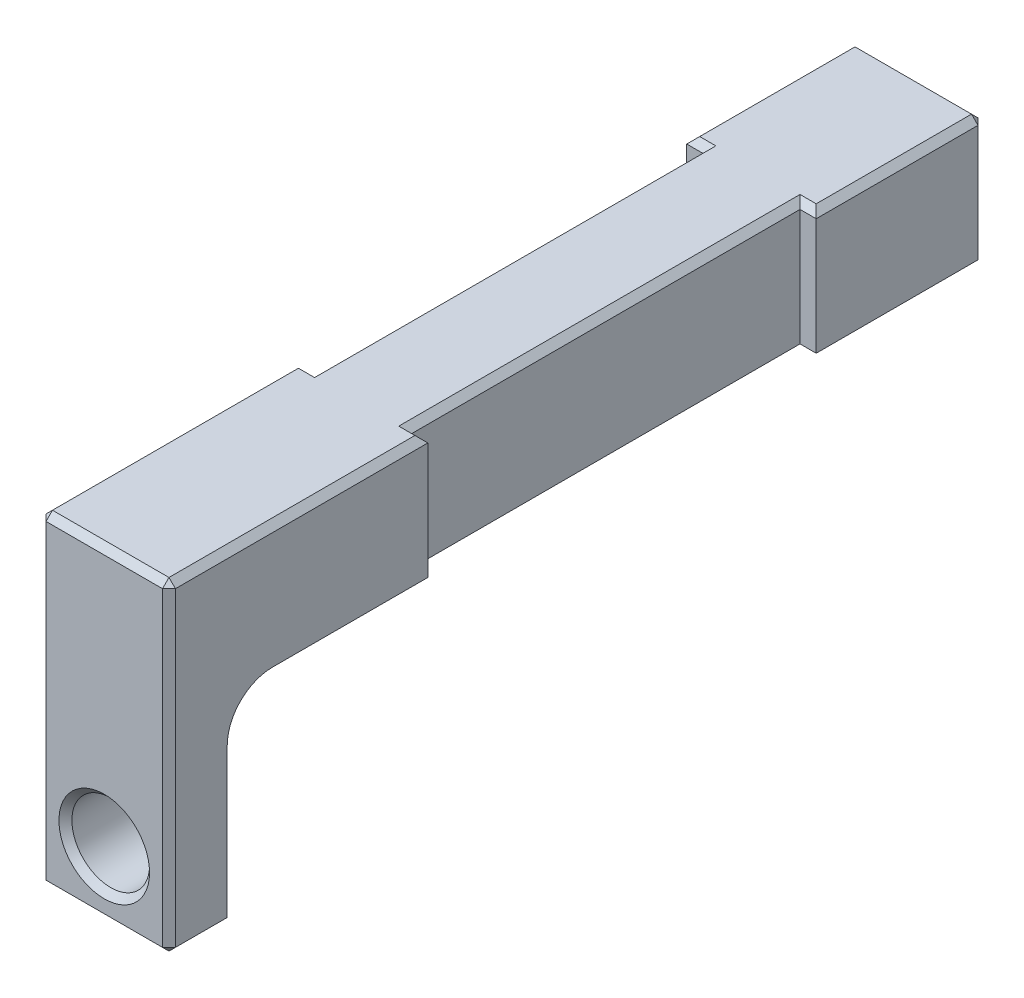
from build123d import *

# Parameters (mm, degrees)
SKETCH1_W            = 10
SKETCH1_H            = 58
BOSS_EXTRUDE1_DEPTH  = 10
CUT_EXTRUDE1_REACH   = 33.081
SKETCH2_W            = 1.25
SKETCH2_H            = 30
SKETCH3_W            = 10
SKETCH3_H            = 25
BOSS_EXTRUDE2_DEPTH  = 5
FILLET1_R            = 3
M5_CLEARANCE_HOLE1_D = 6
CHAMFER1_SIZE        = 0.5


with BuildPart() as part:
    # Sketch1 → Boss-Extrude1 (new body)
    with BuildSketch(Plane(origin=(0, 0, 0), x_dir=(1, 0, 0), z_dir=(0, 1, 0))):
        Rectangle(SKETCH1_W, SKETCH1_H)
    extrude(amount=-BOSS_EXTRUDE1_DEPTH)

    # Sketch2 → Cut-Extrude1 (cut, up to next)
    with BuildSketch(Plane(origin=(0, 0, 0), x_dir=(1, 0, 0), z_dir=(0, 1, 0)), mode=Mode.PRIVATE) as cut_extrude1_sk1:
        with Locations((-4.375, 1)):
            Rectangle(SKETCH2_W, SKETCH2_H)
    cut_extrude1_tool1 = extrude(cut_extrude1_sk1.sketch, amount=-CUT_EXTRUDE1_REACH, mode=Mode.PRIVATE) & part.part
    # Sketch2 → Cut-Extrude1 (cut, up to next)
    with BuildSketch(Plane(origin=(0, 0, 0), x_dir=(1, 0, 0), z_dir=(0, 1, 0)), mode=Mode.PRIVATE) as cut_extrude1_sk2:
        with Locations((4.375, 1)):
            Rectangle(SKETCH2_W, SKETCH2_H)
    cut_extrude1_tool2 = extrude(cut_extrude1_sk2.sketch, amount=-CUT_EXTRUDE1_REACH, mode=Mode.PRIVATE) & part.part
    add(cut_extrude1_tool1.solids().sort_by_distance((-4.375, 0, -1))[0], mode=Mode.SUBTRACT)
    add(cut_extrude1_tool2.solids().sort_by_distance((4.375, 0, -1))[0], mode=Mode.SUBTRACT)

    # Sketch3 → Boss-Extrude2 (add)
    with BuildSketch(Plane.XY.offset(29)):
        with Locations((0, -12.5)):
            Rectangle(SKETCH3_W, SKETCH3_H)
    extrude(amount=BOSS_EXTRUDE2_DEPTH)

    # Fillet1
    fillet1_edges = [part.edges().sort_by_distance(p)[0] for p in [
        (0, -10, 29),
    ]]
    fillet(fillet1_edges, radius=FILLET1_R)

    # M5 Clearance Hole1 (through all)
    with Locations(Plane.XY.offset(34)):
        with Locations((0, -20)):
            Hole(M5_CLEARANCE_HOLE1_D / 2)

    # Chamfer1
    chamfer1_edges = [part.edges().sort_by_distance(p)[0] for p in [
        (-5, -10, -22.5),
        (5, 0, -22.5),
        (-5, 0, 24),
        (5, -10, -22.5),
        (-5, -10, 20),
        (-4.375, -10, -16),
        (-3.75, -10, -1),
        (-4.375, -10, 14),
        (-4.375, 0, 14),
        (-3.75, 0, -1),
        (-4.375, 0, -16),
        (4.375, -10, 14),
        (3.75, -10, -1),
        (4.375, -10, -16),
        (4.375, 0, -16),
        (3.75, 0, -1),
        (4.375, 0, 14),
        (0, -25, 29),
        (-5, -25, 31.5),
        (5, -19, 29),
        (5, -25, 31.5),
        (-5, -12.5, 34),
        (0, -25, 34),
        (5, -12.5, 34),
        (0, 0, 34),
        (-5, 0, -22.5),
        (0, 0, -29),
        (-5, -19, 29),
        (5, -10, 20),
        (5, -10.878679656, 28.121320344),
        (-5, -10.878679656, 28.121320344),
        (5, 0, 24),
        (3, -20, 34),
        (-5, -5, -29),
        (5, -5, -29),
        (0, -10, -29),
    ]]
    chamfer(chamfer1_edges, length=CHAMFER1_SIZE)


solid = part.part
